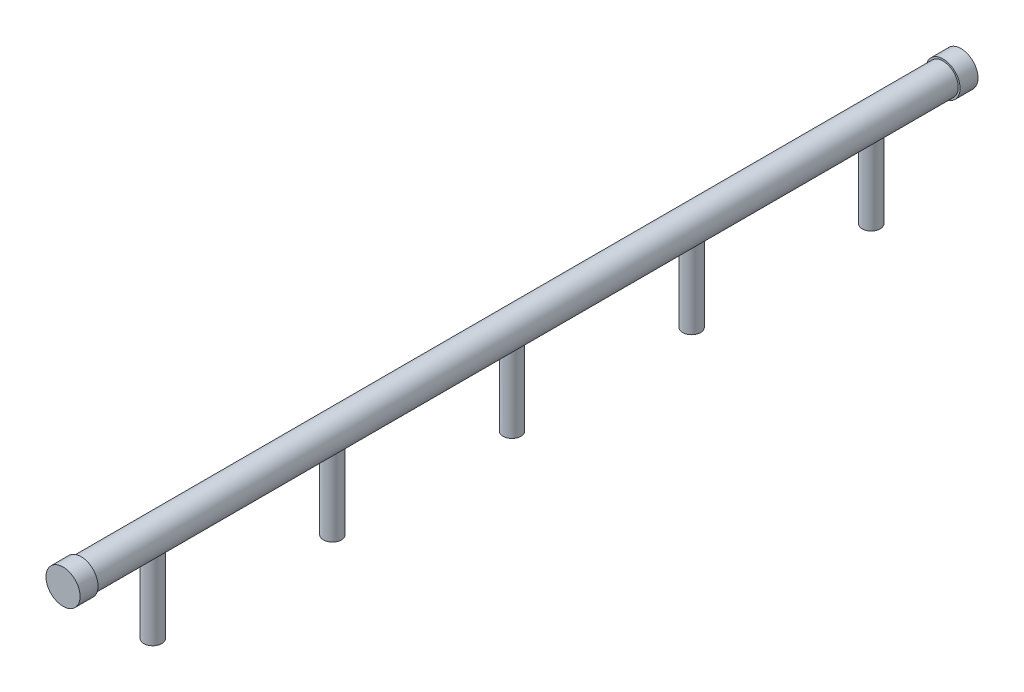
from build123d import *

# Parameters (mm, degrees)
SKETCH1_R           = 17
BOSS_EXTRUDE1_DEPTH = 1000
SKETCH2_R           = 19
BOSS_EXTRUDE2_DEPTH = 20
BOSS_EXTRUDE3_START = -20
SKETCH3_R           = 19
BOSS_EXTRUDE3_DEPTH = 20
SKETCH4_R           = 10
BOSS_EXTRUDE4_DEPTH = 100


with BuildPart() as part:
    # Sketch1 → Boss-Extrude1 (new body)
    with BuildSketch(Plane.XY):
        Circle(SKETCH1_R)
    extrude(amount=BOSS_EXTRUDE1_DEPTH)

    # Sketch2 → Boss-Extrude2 (add)
    with BuildSketch(Plane.XY.offset(1000)):
        Circle(SKETCH2_R)
    extrude(amount=-BOSS_EXTRUDE2_DEPTH)

    # Sketch3 → Boss-Extrude3 (add)
    with BuildSketch(Plane(origin=(0, 0, 0), x_dir=(-1, 0, 0), z_dir=(0, 0, -1)).offset(BOSS_EXTRUDE3_START)):
        with Locations(Location((0, 0, 0), (0, 0, 180))):
            Circle(SKETCH3_R)
    extrude(amount=BOSS_EXTRUDE3_DEPTH)

    # Sketch4 → Boss-Extrude4 (add)
    with BuildSketch(Plane(origin=(0, 0, 0), x_dir=(1, 0, 0), z_dir=(0, 1, 0))):
        with Locations(Location((0, -500, 0), (0, 0, 270))):
            Circle(SKETCH4_R)
        with Locations(Location((0, -300, 0), (0, 0, 270))):
            Circle(SKETCH4_R)
        with Locations(Location((0, -100, 0), (0, 0, 270))):
            Circle(SKETCH4_R)
        with Locations(Location((0, -700, 0), (0, 0, 270))):
            Circle(SKETCH4_R)
        with Locations(Location((0, -900, 0), (0, 0, 270))):
            Circle(SKETCH4_R)
    extrude(amount=-BOSS_EXTRUDE4_DEPTH)


solid = part.part
